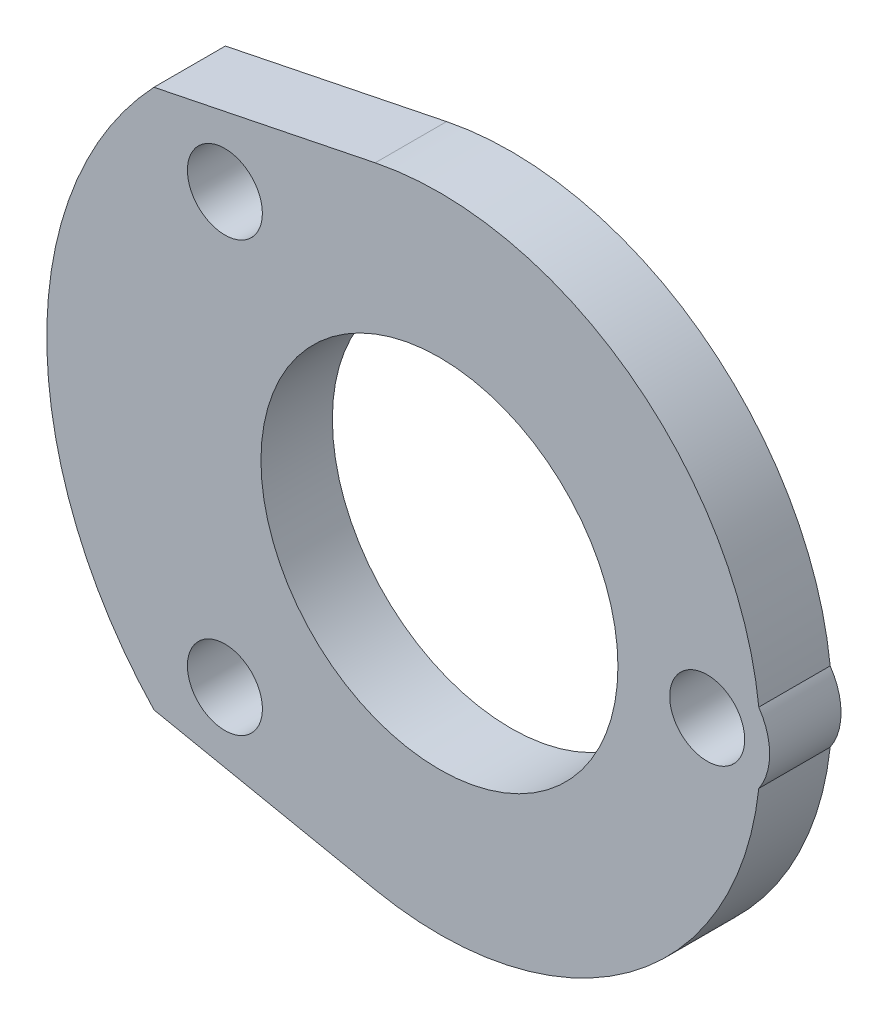
from build123d import *

# Parameters (mm, degrees)
ESQUISSE1_R        = 5
ESQUISSE1_R_2      = 1.05
BOSS_EXTRU_1_DEPTH = 2


with BuildPart() as part:
    # Esquisse1 → Boss.-Extru.1 (new body)
    with BuildSketch(Plane.XY):
        with BuildLine():
            Line((-7.996773354, 7.55325201), (-1.8, 8.818163074))
            ThreePointArc((-1.8, 8.818163074), (5.30110237, 7.27312269), (8.945833333, 0.985934061))
            ThreePointArc((8.945833333, 0.985934061), (9.25, 0), (8.945833333, -0.985934061))
            ThreePointArc((8.945833333, -0.985934061), (5.30110237, -7.27312269), (-1.8, -8.818163074))
            Line((-1.8, -8.818163074), (-7.996773354, -7.55325201))
            ThreePointArc((-7.996773354, -7.55325201), (-11, 0), (-7.996773354, 7.55325201))
        make_face()
        Circle(ESQUISSE1_R, mode=Mode.SUBTRACT)
        with Locations((7.5, 0)):
            Circle(ESQUISSE1_R_2, mode=Mode.SUBTRACT)
        with Locations((-6.01040764, 6.01040764)):
            Circle(ESQUISSE1_R_2, mode=Mode.SUBTRACT)
        with Locations(Location((-6.01040764, -6.01040764, 0), (0, 0, 180))):
            Circle(ESQUISSE1_R_2, mode=Mode.SUBTRACT)
    extrude(amount=BOSS_EXTRU_1_DEPTH)


solid = part.part
